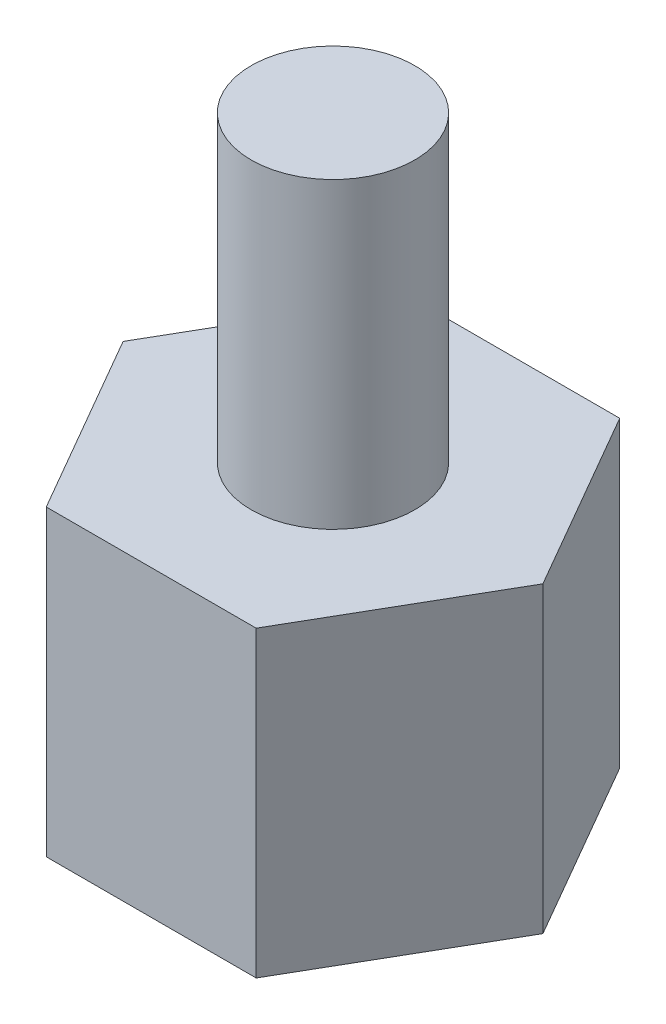
from build123d import *

# Parameters (mm, degrees)
EXTRUDE_1_DEPTH     = 5
SKETCH_2_R          = 1.35
EXTRUDE_2_DEPTH     = 5
SKETCH_3_R          = 1.35
CUT_EXTRUDE_1_DEPTH = 4


with BuildPart() as part:
    # 스케치1 → 보스-돌출1 (new body)
    with BuildSketch(Plane(origin=(0, 0, 0), x_dir=(1, 0, 0), z_dir=(0, 1, 0))):
        Polygon((3.464101615, 0), (1.732050808, 3), (-1.732050808, 3), (-3.464101615, 0), (-1.732050808, -3), (1.732050808, -3), align=None)
    extrude(amount=EXTRUDE_1_DEPTH)

    # 스케치2 → 보스-돌출2 (add)
    with BuildSketch(Plane(origin=(0, 5, 0), x_dir=(1, 0, 0), z_dir=(0, 1, 0))):
        with Locations(Location((0, 0, 0), (0, 0, 270))):
            Circle(SKETCH_2_R)
    extrude(amount=EXTRUDE_2_DEPTH)

    # 스케치3 → 컷-돌출1 (cut)
    with BuildSketch(Plane.XZ):
        with Locations(Location((0, 0, 0), (0, 0, 90))):
            Circle(SKETCH_3_R)
    extrude(amount=-CUT_EXTRUDE_1_DEPTH, mode=Mode.SUBTRACT)


solid = part.part
